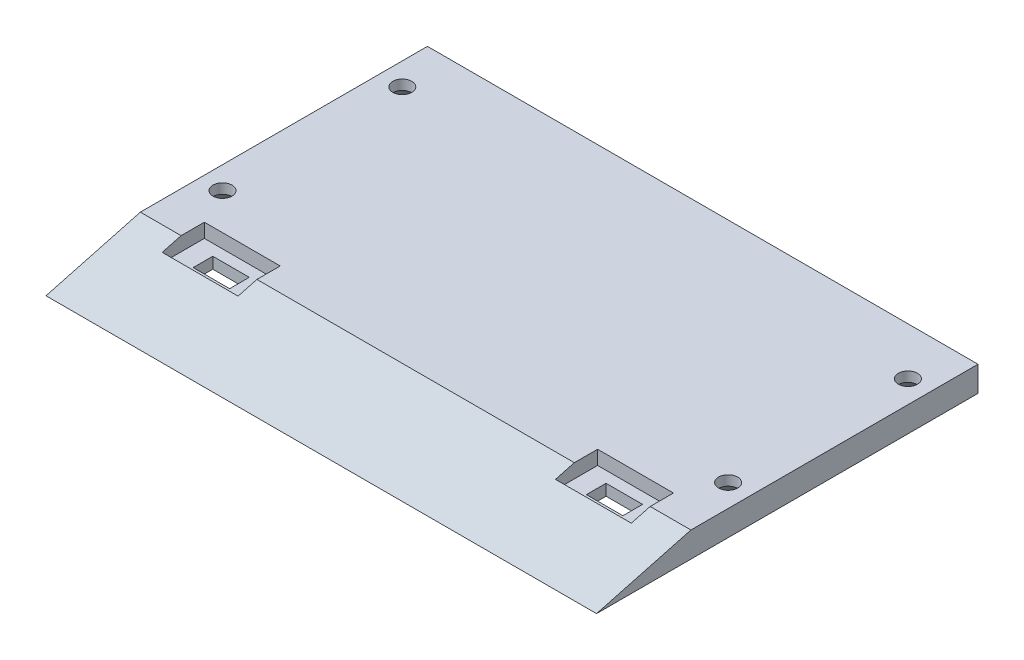
from build123d import *

# Parameters (mm, degrees)
SALIENTE_EXTRUIR1_DEPTH                        = 100
CSK_FOR_M3_FLAT_HEAD_MACHINE_SCREW1_AT_2_COUNT = 2
CSK_FOR_M3_FLAT_HEAD_MACHINE_SCREW1_AT_2_PITCH = 90
CSK_FOR_M3_FLAT_HEAD_MACHINE_SCREW1_AT_3_COUNT = 2
CSK_FOR_M3_FLAT_HEAD_MACHINE_SCREW1_AT_3_PITCH = 95.51963149
CSK_FOR_M3_FLAT_HEAD_MACHINE_SCREW1_AT_4_COUNT = 2
CSK_FOR_M3_FLAT_HEAD_MACHINE_SCREW1_AT_4_PITCH = 32
CROQUIS4_W                                     = 6.5
CROQUIS4_H                                     = 3.5
CORTAR_EXTRUIR3_DEPTH                          = 121.957265181
CROQUIS8_W                                     = 13.5
CROQUIS8_H                                     = 7.5
CORTAR_EXTRUIR4_DEPTH                          = 2.5
CORTAR_EXTRUIR5_DEPTH                          = 1
CROQUIS12_W                                    = 67.9
CROQUIS12_H                                    = 8.529184672
CORTAR_EXTRUIR6_DEPTH                          = 1


with BuildPart() as part:
    # Croquis1 → Saliente-Extruir1 (new body)
    with BuildSketch(Plane(origin=(0, 0, 0), x_dir=(0, 0, -1), z_dir=(1, 0, 0))):
        Polygon((0, 0), (67.9, 0), (67.9, 4.5), (16.794228634, 4.5), align=None)
    extrude(amount=SALIENTE_EXTRUIR1_DEPTH)

    # Croquis3 → CSK for M3 Flat Head Machine Screw1 (revolve, cut)
    with BuildSketch(Plane(origin=(95, 0, -59.42), x_dir=(0, 0, -1), z_dir=(1, 0, 0))):
        Polygon((0, 0), (0, 4.5), (1.7, 4.5), (1.7, 2.741033263), (4, 0), align=None)
    csk_for_m3_flat_head_machine_screw1 = revolve(axis=Axis((95, -6.35, -59.42), (0, 1, 0)), mode=Mode.SUBTRACT)

    # CSK for M3 Flat Head Machine Screw1 at 2: CSK for M3 Flat Head Machine Screw1 ×2
    with Locations(*[(-i * CSK_FOR_M3_FLAT_HEAD_MACHINE_SCREW1_AT_2_PITCH, 0, 0) for i in range(1, CSK_FOR_M3_FLAT_HEAD_MACHINE_SCREW1_AT_2_COUNT)]):
        add(csk_for_m3_flat_head_machine_screw1, mode=Mode.SUBTRACT)

    # CSK for M3 Flat Head Machine Screw1 at 3: CSK for M3 Flat Head Machine Screw1 ×2
    with Locations(*[Vector(-0.9422146902791427, 0, 0.33500966765479934) * (i * CSK_FOR_M3_FLAT_HEAD_MACHINE_SCREW1_AT_3_PITCH) for i in range(1, CSK_FOR_M3_FLAT_HEAD_MACHINE_SCREW1_AT_3_COUNT)]):
        add(csk_for_m3_flat_head_machine_screw1, mode=Mode.SUBTRACT)

    # CSK for M3 Flat Head Machine Screw1 at 4: CSK for M3 Flat Head Machine Screw1 ×2
    with Locations(*[(0, 0, i * CSK_FOR_M3_FLAT_HEAD_MACHINE_SCREW1_AT_4_PITCH) for i in range(1, CSK_FOR_M3_FLAT_HEAD_MACHINE_SCREW1_AT_4_COUNT)]):
        add(csk_for_m3_flat_head_machine_screw1, mode=Mode.SUBTRACT)

    # Croquis4 → Cortar-Extruir3 (cut, through all)
    with BuildSketch(Plane(origin=(0, 4.5, 0), x_dir=(1, 0, 0), z_dir=(0, 1, 0))):
        with Locations((15, 17.19)):
            Rectangle(CROQUIS4_W, CROQUIS4_H)
        with Locations((85, 17.19)):
            Rectangle(CROQUIS4_W, CROQUIS4_H)
    extrude(amount=-CORTAR_EXTRUIR3_DEPTH, mode=Mode.SUBTRACT)

    # Croquis8 → Cortar-Extruir4 (cut)
    with BuildSketch(Plane(origin=(0, 4.5, 0), x_dir=(1, 0, 0), z_dir=(0, 1, 0))):
        with Locations((15, 17.19)):
            Rectangle(CROQUIS8_W, CROQUIS8_H)
        with Locations((85, 17.19)):
            Rectangle(CROQUIS8_W, CROQUIS8_H)
    extrude(amount=-CORTAR_EXTRUIR4_DEPTH, mode=Mode.SUBTRACT)

    # Croquis11 → Cortar-Extruir5 (cut)
    with BuildSketch(Plane(origin=(100, 0, 0), x_dir=(0, 0, -1), z_dir=(1, 0, 0))):
        Polygon((0, 0), (67.9, 0), (67.9, 7.340226628), (-0.455473411, 7.340226628), align=None)
    extrude(amount=-CORTAR_EXTRUIR5_DEPTH, mode=Mode.SUBTRACT)

    # Croquis12 → Cortar-Extruir6 (cut)
    with BuildSketch(Plane.ZY):
        with Locations((-33.95, 4.264592336)):
            Rectangle(CROQUIS12_W, CROQUIS12_H)
    extrude(amount=-CORTAR_EXTRUIR6_DEPTH, mode=Mode.SUBTRACT)


solid = part.part
